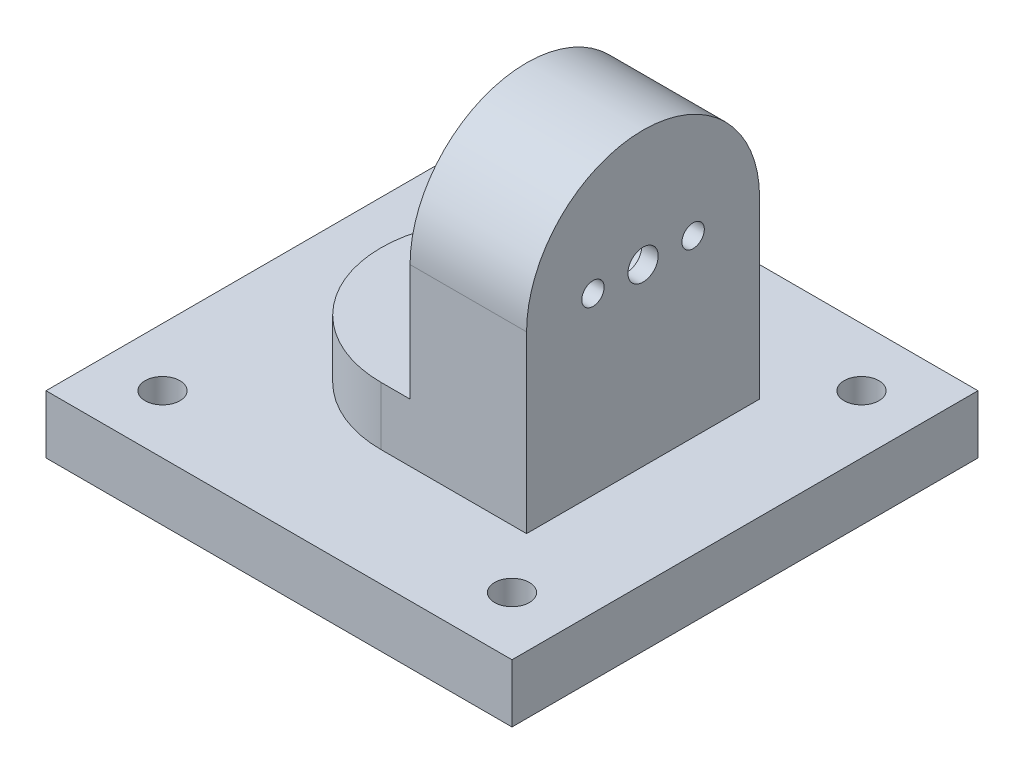
from build123d import *

# Parameters (mm, degrees)
SKETCH1_R                 = 12.7
BOSS_EXTRUDE1_DEPTH       = 6.35
BOSS_EXTRUDE6_START       = -6.35
BOSS_EXTRUDE6_DEPTH       = 6.35
SKETCH15_R                = 12.7
BOSS_EXTRUDE8_DEPTH       = 12.7
SKETCH17_R                = 1.651
CUT_EXTRUDE4_DEPTH        = 12.7
SKETCH18_R                = 3.81
CUT_EXTRUDE5_DEPTH        = 10.9027722
SKETCH19_R                = 8.255
CUT_EXTRUDE6_DEPTH        = 8.3627722
SKETCH20_R                = 9.525
CUT_EXTRUDE7_DEPTH        = 5.1877722
SKETCH21_R                = 1.2192
CUT_EXTRUDE8_DEPTH        = 4.3372278
SKETCH22_W                = 50.8
SKETCH22_H                = 50.8
BOSS_EXTRUDE9_DEPTH       = 6.35
F_6_CLEARANCE_HOLE1_D     = 3.7973
F_6_CLEARANCE_HOLE1_DEPTH = 25.4
F_6_CLEARANCE_HOLE1_TIP   = 1.140824014


with BuildPart() as part:
    # Sketch1 → Boss-Extrude1 (new body)
    with BuildSketch(Plane(origin=(0, 0, 0), x_dir=(1, 0, 0), z_dir=(0, 1, 0))):
        with Locations(Location((0, 0, 0), (0, 0, 270))):
            Circle(SKETCH1_R)
    extrude(amount=BOSS_EXTRUDE1_DEPTH)

    # Sketch14 → Boss-Extrude6 (add)
    with BuildSketch(Plane(origin=(0, 6.35, 0), x_dir=(1, 0, 0), z_dir=(0, 1, 0)).offset(BOSS_EXTRUDE6_START)):
        with BuildLine():
            Line((15.875, 12.7), (0, 12.7))
            ThreePointArc((0, 12.7), (8.980256121, 8.980256121), (12.7, 0))
            ThreePointArc((12.7, 0), (8.980256121, -8.980256121), (0, -12.7))
            Line((0, -12.7), (15.875, -12.7))
            Line((15.875, -12.7), (15.875, 12.7))
        make_face()
    extrude(amount=BOSS_EXTRUDE6_DEPTH)

    # Sketch15 → Boss-Extrude8 (add)
    with BuildSketch(Plane(origin=(15.875, 0, 0), x_dir=(0, 0, -1), z_dir=(1, 0, 0))):
        with Locations((0, 19.05)):
            Circle(SKETCH15_R)
        with BuildLine():
            ThreePointArc((-3e-08, 6.35), (-8.980256132, 10.06974389), (-12.7, 19.05))
            Line((-12.7, 19.05), (-12.7, 6.35))
            Line((-12.7, 6.35), (-3e-08, 6.35))
        make_face()
        with BuildLine():
            Line((12.7, 6.35), (12.7, 19.05))
            ThreePointArc((12.7, 19.05), (8.98025611, 10.069743868), (-3e-08, 6.35))
            Line((-3e-08, 6.35), (12.7, 6.35))
        make_face()
    extrude(amount=-BOSS_EXTRUDE8_DEPTH)

    # Sketch17 → Cut-Extrude4 (cut)
    with BuildSketch(Plane.ZY.offset(-3.175)):
        with Locations((0, 19.05)):
            Circle(SKETCH17_R)
    extrude(amount=-CUT_EXTRUDE4_DEPTH, mode=Mode.SUBTRACT)

    # Sketch18 → Cut-Extrude5 (cut)
    with BuildSketch(Plane.ZY.offset(-3.175)):
        with Locations((0, 19.05)):
            Circle(SKETCH18_R)
    extrude(amount=-CUT_EXTRUDE5_DEPTH, mode=Mode.SUBTRACT)

    # Sketch19 → Cut-Extrude6 (cut)
    with BuildSketch(Plane.ZY.offset(-3.175)):
        with Locations((0, 19.05)):
            Circle(SKETCH19_R)
    extrude(amount=-CUT_EXTRUDE6_DEPTH, mode=Mode.SUBTRACT)

    # Sketch20 → Cut-Extrude7 (cut)
    with BuildSketch(Plane.ZY.offset(-3.175)):
        with Locations((0, 19.05)):
            Circle(SKETCH20_R)
    extrude(amount=-CUT_EXTRUDE7_DEPTH, mode=Mode.SUBTRACT)

    # Sketch21 → Cut-Extrude8 (cut)
    with BuildSketch(Plane.ZY.offset(-11.5377722)):
        with Locations((5.4599967, 19.05)):
            Circle(SKETCH21_R)
        with Locations((-5.4599967, 19.05)):
            Circle(SKETCH21_R)
    extrude(amount=-CUT_EXTRUDE8_DEPTH, mode=Mode.SUBTRACT)

    # Sketch22 → Boss-Extrude9 (add)
    with BuildSketch(Plane.XZ):
        with Locations((1.5875, 0)):
            Rectangle(SKETCH22_W, SKETCH22_H)
    extrude(amount=BOSS_EXTRUDE9_DEPTH)

    # #6 Clearance Hole1
    with Locations(Plane(origin=(0, -6.35, 0), x_dir=(-1, 0, 0), z_dir=(0, -1, 0))):
        with Locations((-20.6375, 19.05), (17.4625, 19.05), (17.4625, -19.05), (-20.6375, -19.05)):
            Hole(F_6_CLEARANCE_HOLE1_D / 2, depth=F_6_CLEARANCE_HOLE1_DEPTH)
            with Locations((0, 0, -(F_6_CLEARANCE_HOLE1_DEPTH + F_6_CLEARANCE_HOLE1_TIP / 2))):  # 118° drill point
                Cone(0, F_6_CLEARANCE_HOLE1_D / 2, F_6_CLEARANCE_HOLE1_TIP, mode=Mode.SUBTRACT)


solid = part.part
